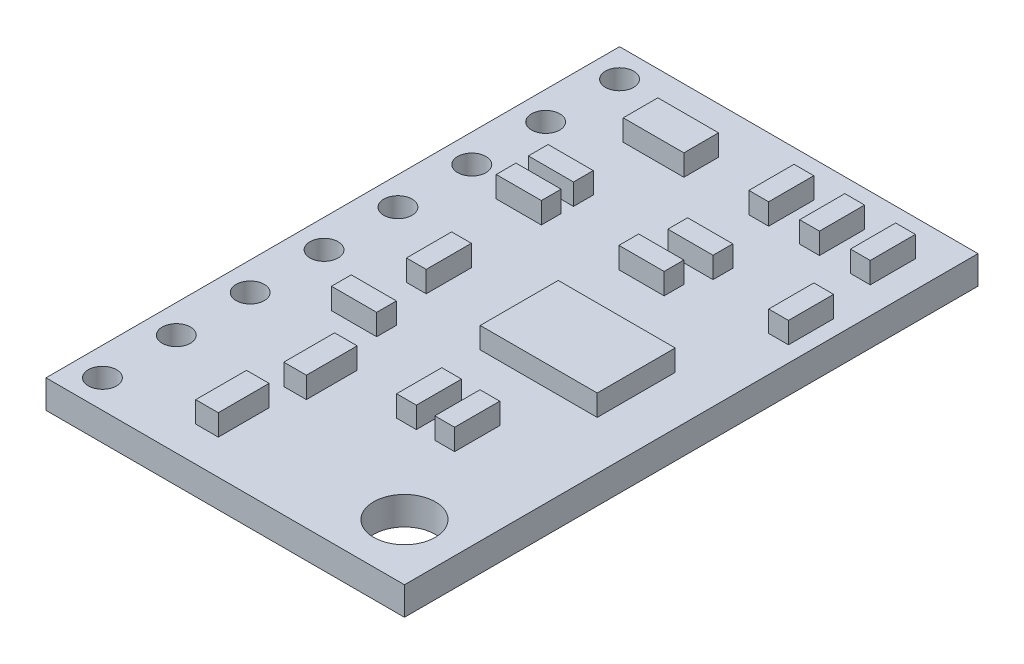
from build123d import *

# Parameters (mm, degrees)
SKETCH1_W           = 12.7
SKETCH1_H           = 20.32
BOSS_EXTRUDE1_DEPTH = 1
SKETCH2_R           = 0.5
SKETCH2_R_2         = 1.0922
CUT_EXTRUDE2_DEPTH  = 1
SKETCH3_W           = 0.7
SKETCH3_H           = 1.6
SKETCH3_W_2         = 2.149156966
SKETCH3_H_2         = 1.228089695
SKETCH3_W_3         = 4.14480272
SKETCH3_H_3         = 2.763201813
SKETCH3_W_4         = 0.8
SKETCH3_H_4         = 1.8
SKETCH3_W_5         = 1.6
SKETCH3_H_5         = 0.7
BOSS_EXTRUDE3_DEPTH = 0.75


with BuildPart() as part:
    # Sketch1 → Boss-Extrude1 (new body)
    with BuildSketch(Plane(origin=(0, 0, 0), x_dir=(1, 0, 0), z_dir=(0, 1, 0))):
        with Locations((6.35, 10.16)):
            Rectangle(SKETCH1_W, SKETCH1_H)
    extrude(amount=BOSS_EXTRUDE1_DEPTH)

    # Sketch2 → Cut-Extrude2 (cut)
    with BuildSketch(Plane(origin=(0, 1, 0), x_dir=(1, 0, 0), z_dir=(0, 1, 0))):
        with Locations(Location((1, 19.32, 0), (0, 0, 270))):
            Circle(SKETCH2_R)
        with Locations(Location((1, 16.702857143, 0), (0, 0, 270))):
            Circle(SKETCH2_R)
        with Locations(Location((1, 14.085714286, 0), (0, 0, 270))):
            Circle(SKETCH2_R)
        with Locations(Location((1, 11.468571429, 0), (0, 0, 270))):
            Circle(SKETCH2_R)
        with Locations(Location((1, 8.851428571, 0), (0, 0, 270))):
            Circle(SKETCH2_R)
        with Locations(Location((1, 6.234285714, 0), (0, 0, 270))):
            Circle(SKETCH2_R)
        with Locations(Location((1, 3.617142857, 0), (0, 0, 270))):
            Circle(SKETCH2_R)
        with Locations(Location((1, 1, 0), (0, 0, 270))):
            Circle(SKETCH2_R)
        with Locations(Location((10.7, 2, 0), (0, 0, 270))):
            Circle(SKETCH2_R_2)
    extrude(amount=-CUT_EXTRUDE2_DEPTH, mode=Mode.SUBTRACT)

    # Sketch3 → Boss-Extrude3 (add)
    with BuildSketch(Plane(origin=(0, 1, 0), x_dir=(1, 0, 0), z_dir=(0, 1, 0))):
        with Locations((9.600163685, 18.251782562)):
            Rectangle(SKETCH3_W, SKETCH3_H)
        with Locations((4.072917024, 18.06582741)):
            Rectangle(SKETCH3_W_2, SKETCH3_H_2)
        with Locations((8.908520197, 9.929733183)):
            Rectangle(SKETCH3_W_3, SKETCH3_H_3)
        with Locations((4.882280256, 4.84279592)):
            Rectangle(SKETCH3_W_4, SKETCH3_H_4)
        with Locations((4.472917024, 2.130764511)):
            Rectangle(SKETCH3_W_4, SKETCH3_H_4)
        with Locations((7.800163685, 18.251782562)):
            Rectangle(SKETCH3_W, SKETCH3_H)
        with Locations((11.400163685, 18.251782562)):
            Rectangle(SKETCH3_W, SKETCH3_H)
        with Locations((11.791455193, 14.963159232)):
            Rectangle(SKETCH3_W, SKETCH3_H)
        with Locations((3.286634502, 14.952625597)):
            Rectangle(SKETCH3_W_5, SKETCH3_H_5)
        with Locations((3.286634502, 13.813159232)):
            Rectangle(SKETCH3_W_5, SKETCH3_H_5)
        with Locations((8.005018674, 15.176499715)):
            Rectangle(SKETCH3_W_5, SKETCH3_H_5)
        with Locations((7.636118837, 13.813159232)):
            Rectangle(SKETCH3_W_5, SKETCH3_H_5)
        with Locations((3.808428935, 10.112643834)):
            Rectangle(SKETCH3_W, SKETCH3_H)
        with Locations((7.800163685, 5.771046806)):
            Rectangle(SKETCH3_W, SKETCH3_H)
        with Locations((9.155018674, 5.771046806)):
            Rectangle(SKETCH3_W, SKETCH3_H)
        with Locations((3.798338541, 7.466211291)):
            Rectangle(SKETCH3_W_5, SKETCH3_H_5)
    extrude(amount=BOSS_EXTRUDE3_DEPTH)


solid = part.part
